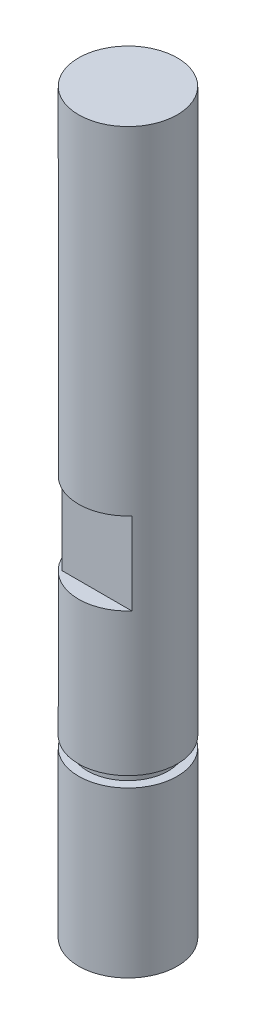
from build123d import *

# Parameters (mm, degrees)
SKETCH1_R           = 3
BOSS_EXTRUDE1_DEPTH = 10
SKETCH2_R           = 2.45
BOSS_EXTRUDE2_DEPTH = 0.65
SKETCH3_R           = 3
BOSS_EXTRUDE3_DEPTH = 8.67
BOSS_EXTRUDE4_DEPTH = 5
SKETCH5_R           = 3
BOSS_EXTRUDE5_DEPTH = 20.5


with BuildPart() as part:
    # Sketch1 → Boss-Extrude1 (new body)
    with BuildSketch(Plane(origin=(0, 0, 0), x_dir=(1, 0, 0), z_dir=(0, 1, 0))):
        with Locations(Location((0, 0, 0), (0, 0, 270))):
            Circle(SKETCH1_R)
    extrude(amount=BOSS_EXTRUDE1_DEPTH)

    # Sketch2 → Boss-Extrude2 (add)
    with BuildSketch(Plane(origin=(0, 10, 0), x_dir=(1, 0, 0), z_dir=(0, 1, 0))):
        with Locations(Location((0, 0, 0), (0, 0, 270))):
            Circle(SKETCH2_R)
    extrude(amount=BOSS_EXTRUDE2_DEPTH)

    # Sketch3 → Boss-Extrude3 (add)
    with BuildSketch(Plane(origin=(0, 10.65, 0), x_dir=(1, 0, 0), z_dir=(0, 1, 0))):
        with Locations(Location((0, 0, 0), (0, 0, 270))):
            Circle(SKETCH3_R)
    extrude(amount=BOSS_EXTRUDE3_DEPTH)

    # Sketch4 → Boss-Extrude4 (add)
    with BuildSketch(Plane(origin=(0, 19.32, 0), x_dir=(1, 0, 0), z_dir=(0, 1, 0))):
        with BuildLine():
            Line((-2, -2), (2.236067977, -2))
            ThreePointArc((2.236067977, -2), (2.802517077, -1.070466269), (3, 0))
            ThreePointArc((3, 0), (2.121320344, 2.121320344), (0, 3))
            ThreePointArc((0, 3), (-1.070466269, 2.802517077), (-2, 2.236067977))
            Line((-2, 2.236067977), (-2, -2))
        make_face()
    extrude(amount=BOSS_EXTRUDE4_DEPTH)

    # Sketch5 → Boss-Extrude5 (add)
    with BuildSketch(Plane(origin=(0, 24.32, 0), x_dir=(1, 0, 0), z_dir=(0, 1, 0))):
        with Locations(Location((0, 0, 0), (0, 0, 270))):
            Circle(SKETCH5_R)
    extrude(amount=BOSS_EXTRUDE5_DEPTH)


solid = part.part
